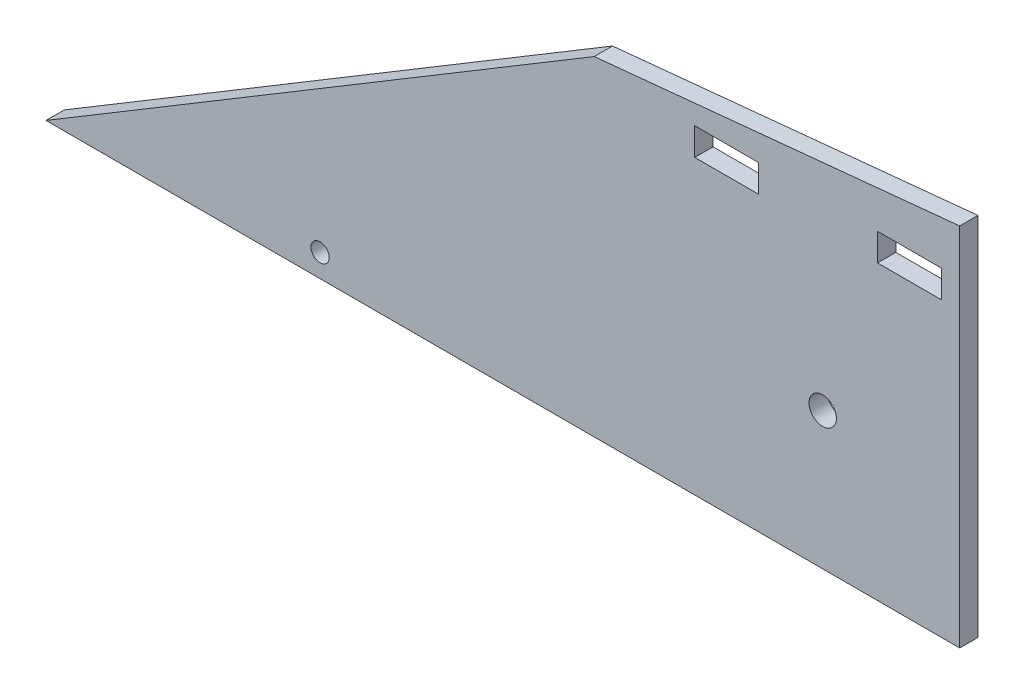
from build123d import *

# Parameters (mm, degrees)
EXTRUDE_1_DEPTH     = 20
SKETCH_2_R          = 15
SKETCH_2_R_2        = 10
SKETCH_2_W          = 70
SKETCH_2_H          = 30
CUT_EXTRUDE_2_DEPTH = 20


with BuildPart() as part:
    # 草图1 → 凸台-拉伸1 (new body)
    with BuildSketch(Plane.XY):
        Polygon((-938.635343121, 0), (61.364656879, 0), (61.364656879, 400), (-338.635343121, 360.555127546), align=None)
    extrude(amount=EXTRUDE_1_DEPTH)

    # 草图2 → 切除-拉伸2 (cut)
    with BuildSketch(Plane.XY):
        with Locations(Location((-88.635343121, 150, 0), (0, 0, 180))):
            Circle(SKETCH_2_R)
        with Locations(Location((-638.635343121, 25, 0), (0, 0, 180))):
            Circle(SKETCH_2_R_2)
        with Locations((-193.635343121, 335)):
            Rectangle(SKETCH_2_W, SKETCH_2_H)
        with Locations((6.364656879, 335)):
            Rectangle(SKETCH_2_W, SKETCH_2_H)
    extrude(amount=CUT_EXTRUDE_2_DEPTH, mode=Mode.SUBTRACT)


solid = part.part
